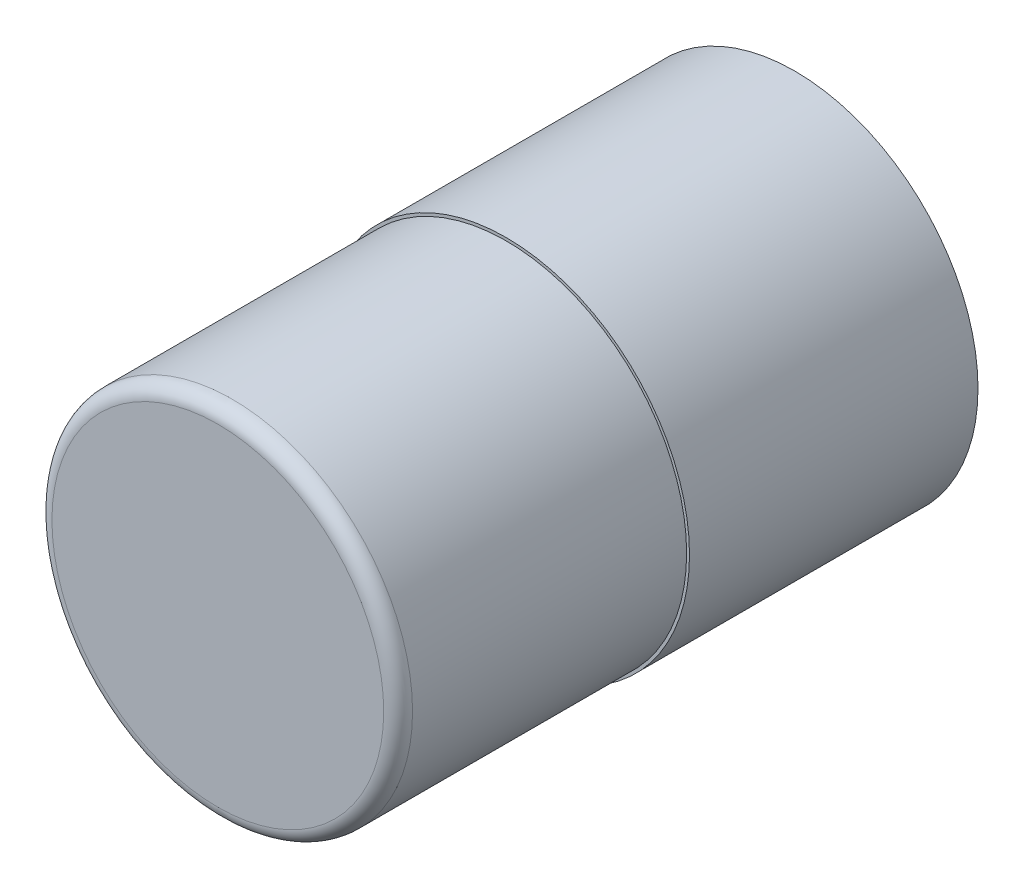
from build123d import *

# Parameters (mm, degrees)
SKETCH1_R           = 6.35
SKETCH1_R_2         = 2.8
BOSS_EXTRUDE2_DEPTH = 10
SKETCH2_R           = 6.35
BOSS_EXTRUDE3_DEPTH = 10
CUT_EXTRUDE1_START  = -10
SKETCH3_R           = 6.35
SKETCH3_R_2         = 6.25
CUT_EXTRUDE1_DEPTH  = 10
FILLET1_R           = 0.5


with BuildPart() as part:
    # Sketch1 → Boss-Extrude2 (new body)
    with BuildSketch(Plane.XY):
        Circle(SKETCH1_R)
        Circle(SKETCH1_R_2, mode=Mode.SUBTRACT)
    extrude(amount=BOSS_EXTRUDE2_DEPTH)

    # Sketch2 → Boss-Extrude3 (add)
    with BuildSketch(Plane.XY.offset(10)):
        Circle(SKETCH2_R)
    extrude(amount=BOSS_EXTRUDE3_DEPTH)

    # Sketch3 → Cut-Extrude1 (cut)
    with BuildSketch(Plane.XY.offset(20).offset(CUT_EXTRUDE1_START)):
        Circle(SKETCH3_R)
        Circle(SKETCH3_R_2, mode=Mode.SUBTRACT)
    extrude(amount=CUT_EXTRUDE1_DEPTH, mode=Mode.SUBTRACT)

    # Fillet1
    fillet1_edges = [part.edges().sort_by_distance(p)[0] for p in [
        (-6.25, 0, 20),
    ]]
    fillet(fillet1_edges, radius=FILLET1_R)


solid = part.part
